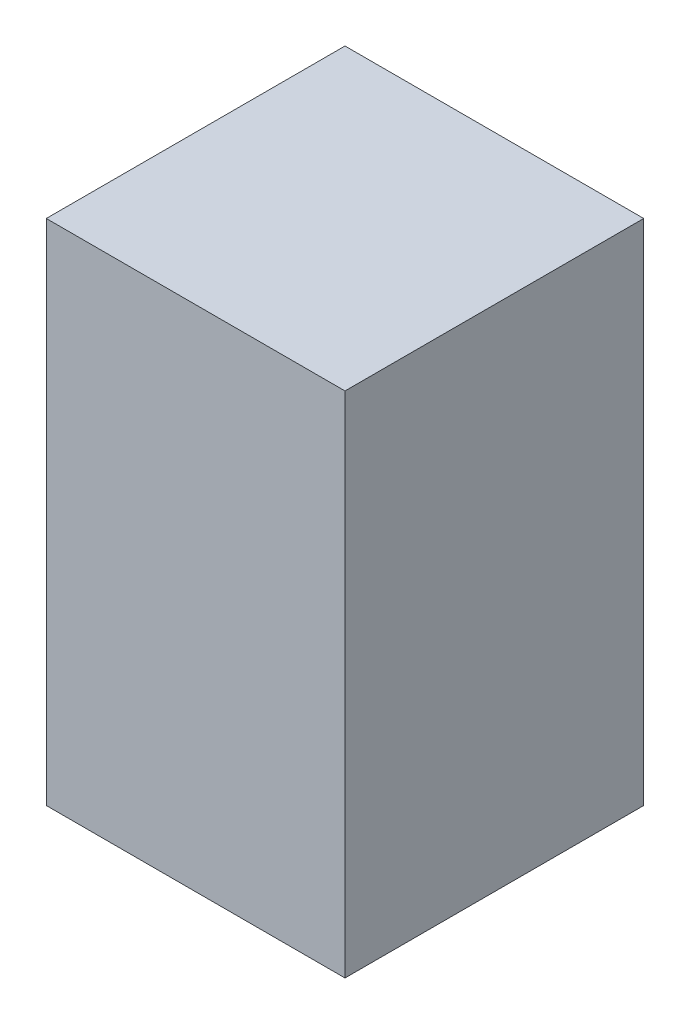
from build123d import *

# Parameters (mm, degrees)
SKETCH1_W           = 100
SKETCH1_H           = 100
BOSS_EXTRUDE1_DEPTH = 170.2
SKETCH2_R           = 38.629656057
CUT_EXTRUDE1_DEPTH  = 39.2
SKETCH3_R           = 26.36678746
BOSS_EXTRUDE2_DEPTH = 39.2


with BuildPart() as part:
    # Sketch1 → Boss-Extrude1 (new body)
    with BuildSketch(Plane(origin=(0, 0, 0), x_dir=(1, 0, 0), z_dir=(0, 1, 0))):
        Rectangle(SKETCH1_W, SKETCH1_H)
    extrude(amount=BOSS_EXTRUDE1_DEPTH)

    # Sketch2 → Cut-Extrude1 (cut)
    with BuildSketch(Plane.XZ):
        with Locations(Location((0, 0, 0), (0, 0, 270))):
            Circle(SKETCH2_R)
    extrude(amount=-CUT_EXTRUDE1_DEPTH, mode=Mode.SUBTRACT)

    # Sketch3 → Boss-Extrude2 (add)
    with BuildSketch(Plane.XZ.offset(-39.2)):
        with Locations(Location((0, 0, 0), (0, 0, 270))):
            Circle(SKETCH3_R)
    extrude(amount=BOSS_EXTRUDE2_DEPTH)


solid = part.part
